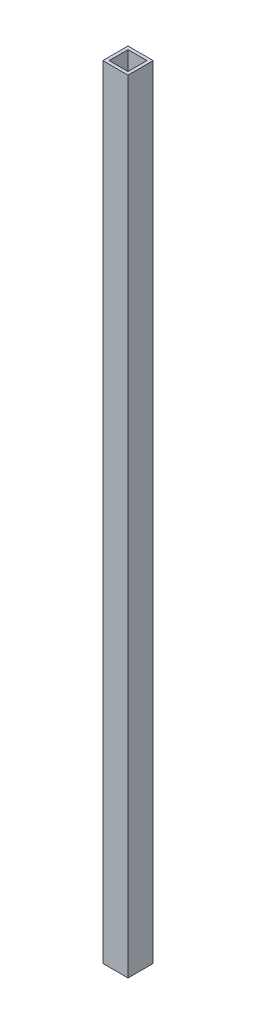
from build123d import *

# Parameters (mm, degrees)
SKETCH2_W           = 25.4
SKETCH2_H           = 25.4
SKETCH2_W_2         = 19.05
SKETCH2_H_2         = 19.05
BOSS_EXTRUDE1_DEPTH = 787.4


with BuildPart() as part:
    # Sketch2 → Boss-Extrude1 (new body)
    with BuildSketch(Plane(origin=(0, 0, 0), x_dir=(1, 0, 0), z_dir=(0, 1, 0))):
        with Locations((12.7, 12.7)):
            Rectangle(SKETCH2_W, SKETCH2_H)
        with Locations((12.7, 12.7)):
            Rectangle(SKETCH2_W_2, SKETCH2_H_2, mode=Mode.SUBTRACT)
    extrude(amount=BOSS_EXTRUDE1_DEPTH)


solid = part.part
